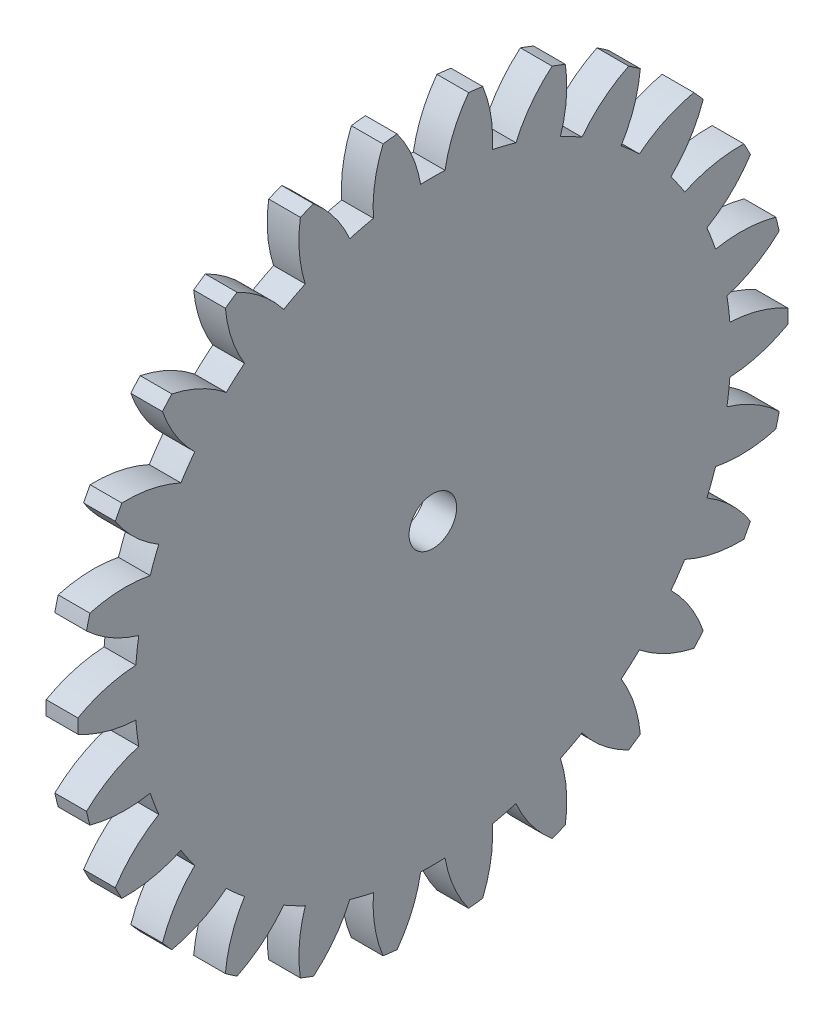
from build123d import *

# Parameters (mm, degrees)
BASPROSKE_W     = 3.175
BASPROSKE_H     = 35.56
TOOTHCUT_DEPTH  = 51.389560675
TEETHCUTS_COUNT = 26
TEETHCUTS_ANGLE = 346.153846154
BORSKE_R        = 2.38125
BORE_DEPTH      = 50.8000508


with BuildPart() as part:
    # BasProSke → Base-Revolve (revolve)
    with BuildSketch(Plane(origin=(0, 0, 0), x_dir=(1, 0, 0), z_dir=(0, 1, 0)), mode=Mode.PRIVATE) as base_revolve_sk:
        with Locations((1.5875, 17.78)):
            Rectangle(BASPROSKE_W, BASPROSKE_H)
    revolve(base_revolve_sk.sketch.rotate(Axis((-10, 0, 0), (1, 0, 0)), 180), axis=Axis((-10, 0, 0), (1, 0, 0)))

    # TooCutSke → ToothCut (cut, through all)
    with BuildSketch(Plane(origin=(0, 0, 0), x_dir=(0, 0, -1), z_dir=(1, 0, 0))):
        with BuildLine():
            ThreePointArc((1.219749282, 29.818793269), (0, 29.84373), (-1.219749282, 29.818793269))
            ThreePointArc((-1.219749282, 29.818793269), (-2.084630009, 32.749405875), (-3.59979086, 35.402855802))
            ThreePointArc((-3.59979086, 35.402855802), (0, 35.5854), (3.59979086, 35.402855802))
            ThreePointArc((3.59979086, 35.402855802), (2.084630009, 32.749405875), (1.219749282, 29.818793269))
        make_face()
    toothcut = extrude(amount=TOOTHCUT_DEPTH, mode=Mode.SUBTRACT)

    # TeethCuts: ToothCut ×26 about axis
    teethcuts_axis = Axis((-10, 0, 0), (1, 0, 0))
    for i in range(1, TEETHCUTS_COUNT):
        add(toothcut.rotate(teethcuts_axis, i * TEETHCUTS_ANGLE / (TEETHCUTS_COUNT - 1)), mode=Mode.SUBTRACT)

    # BorSke → Bore (cut, symmetric)
    with BuildSketch(Plane(origin=(0, 0, 0), x_dir=(0, 0, -1), z_dir=(1, 0, 0))):
        with Locations(Location((0, 0, 0), (0, 0, 180))):
            Circle(BORSKE_R)
    extrude(amount=BORE_DEPTH, both=True, mode=Mode.SUBTRACT)


solid = part.part
